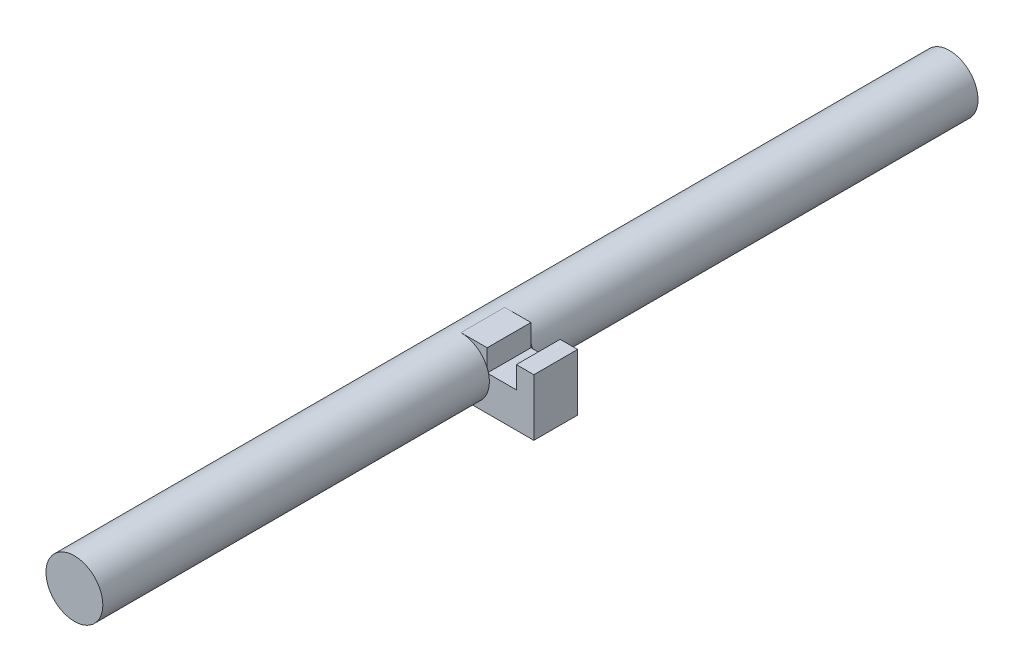
from build123d import *

# Parameters (mm, degrees)
SKETCH_1_R          = 1.95
EXTRUDE_1_DEPTH     = 60
SKETCH1_W           = 3
SKETCH1_H           = 3.9
BOSS_EXTRUDE1_DEPTH = 5
SKETCH2_W           = 2
SKETCH2_H           = 1.5
CUT_EXTRUDE1_DEPTH  = 3


with BuildPart() as part:
    # 草图1 → 凸台-拉伸1 (new body)
    with BuildSketch(Plane.XY):
        Circle(SKETCH_1_R)
    extrude(amount=EXTRUDE_1_DEPTH)

    # Sketch1 → Boss-Extrude1 (add)
    with BuildSketch(Plane(origin=(0, 0, 0), x_dir=(0, 0, -1), z_dir=(1, 0, 0))):
        with Locations((-32, 0)):
            Rectangle(SKETCH1_W, SKETCH1_H)
    extrude(amount=BOSS_EXTRUDE1_DEPTH)

    # Sketch2 → Cut-Extrude1 (cut)
    with BuildSketch(Plane(origin=(0, 0, 30.5), x_dir=(-1, 0, 0), z_dir=(0, 0, -1))):
        with Locations((-2.8, 1.2)):
            Rectangle(SKETCH2_W, SKETCH2_H)
    extrude(amount=-CUT_EXTRUDE1_DEPTH, mode=Mode.SUBTRACT)


solid = part.part
